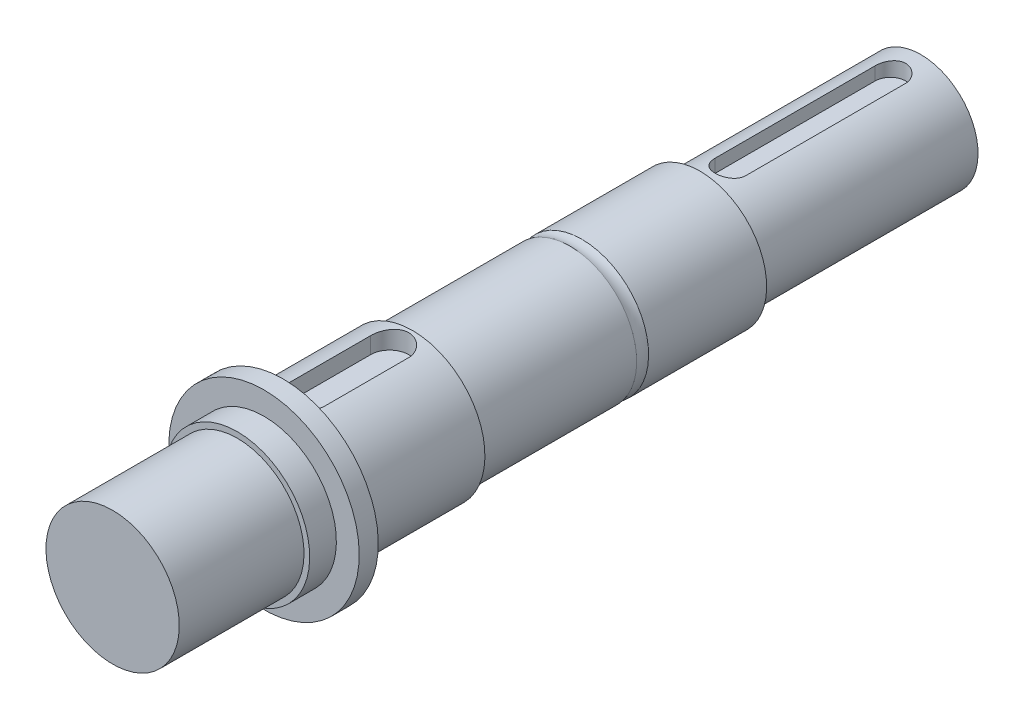
from build123d import *

# Parameters (mm, degrees)
CUT_EXTRUDE1_REACH      = 219.22
CUT_EXTRUDE1_END_RADIUS = 19
CUT_EXTRUDE2_REACH      = 218.701
CUT_EXTRUDE2_END_RADIUS = 15


with BuildPart() as part:
    # Sketch1 → Revolve1 (revolve)
    with BuildSketch(Plane(origin=(0, 0, 0), x_dir=(0, 0, -1), z_dir=(1, 0, 0))):
        with BuildLine():
            Line((0, 0), (0, 15))
            Line((0, 15), (-58, 15))
            Line((-58, 15), (-58, 17.5))
            Line((-58, 17.5), (-89, 17.5))
            ThreePointArc((-89, 17.5), (-90.5612495, 17.25), (-92.122498999, 17.5))
            Line((-92.122498999, 17.5), (-133.472498999, 17.5))
            Line((-133.472498999, 17.5), (-133.472498999, 19))
            Line((-133.472498999, 19), (-167.472498999, 19))
            Line((-167.472498999, 19), (-167.472498999, 25))
            Line((-167.472498999, 25), (-172.472498999, 25))
            Line((-172.472498999, 25), (-172.472498999, 19))
            Line((-172.472498999, 19), (-179.472498999, 19))
            Line((-179.472498999, 19), (-179.472498999, 17.5))
            Line((-179.472498999, 17.5), (-212.222498999, 17.5))
            Line((-212.222498999, 17.5), (-212.222498999, 0))
            Line((-212.222498999, 0), (0, 0))
        make_face()
    revolve(axis=Axis((0, 0, 0), (0, 0, 1)))

    # Cut-Extrude1: up to this cylinder (the profile starts inside it)
    cut_extrude1_end = Plane(origin=(0, 0, 150.472499), z_dir=(0, 0, -1)) * Cylinder(CUT_EXTRUDE1_END_RADIUS, 477.44, mode=Mode.PRIVATE)
    # Sketch2 → Cut-Extrude1 (cut, up to the surface)
    with BuildSketch(Plane(origin=(0, 14, 0), x_dir=(1, 0, 0), z_dir=(0, 1, 0)), mode=Mode.PRIVATE) as cut_extrude1_sk1:
        with BuildLine():
            Line((5, -139.472498999), (5, -161.472498999))
            ThreePointArc((5, -161.472498999), (0, -166.472498999), (-5, -161.472498999))
            Line((-5, -161.472498999), (-5, -139.472498999))
            ThreePointArc((-5, -139.472498999), (0, -134.472498999), (5, -139.472498999))
        make_face()
    cut_extrude1_tool1 = extrude(cut_extrude1_sk1.sketch, amount=CUT_EXTRUDE1_REACH, mode=Mode.PRIVATE) & cut_extrude1_end
    add(cut_extrude1_tool1.solids().sort_by_distance((0, 14, 150.472499))[0], mode=Mode.SUBTRACT)

    # Cut-Extrude2: up to this cylinder (the profile starts inside it)
    cut_extrude2_end = Plane(origin=(0, 0, 29), z_dir=(0, 0, -1)) * Cylinder(CUT_EXTRUDE2_END_RADIUS, 468.402, mode=Mode.PRIVATE)
    # Sketch3 → Cut-Extrude2 (cut, up to the surface)
    with BuildSketch(Plane(origin=(0, 11, 0), x_dir=(1, 0, 0), z_dir=(0, 1, 0)), mode=Mode.PRIVATE) as cut_extrude2_sk1:
        with BuildLine():
            Line((-4, -50), (-4, -8))
            ThreePointArc((-4, -8), (0, -4), (4, -8))
            Line((4, -8), (4, -50))
            ThreePointArc((4, -50), (0, -54), (-4, -50))
        make_face()
    cut_extrude2_tool1 = extrude(cut_extrude2_sk1.sketch, amount=CUT_EXTRUDE2_REACH, mode=Mode.PRIVATE) & cut_extrude2_end
    add(cut_extrude2_tool1.solids().sort_by_distance((0, 11, 29))[0], mode=Mode.SUBTRACT)


solid = part.part
